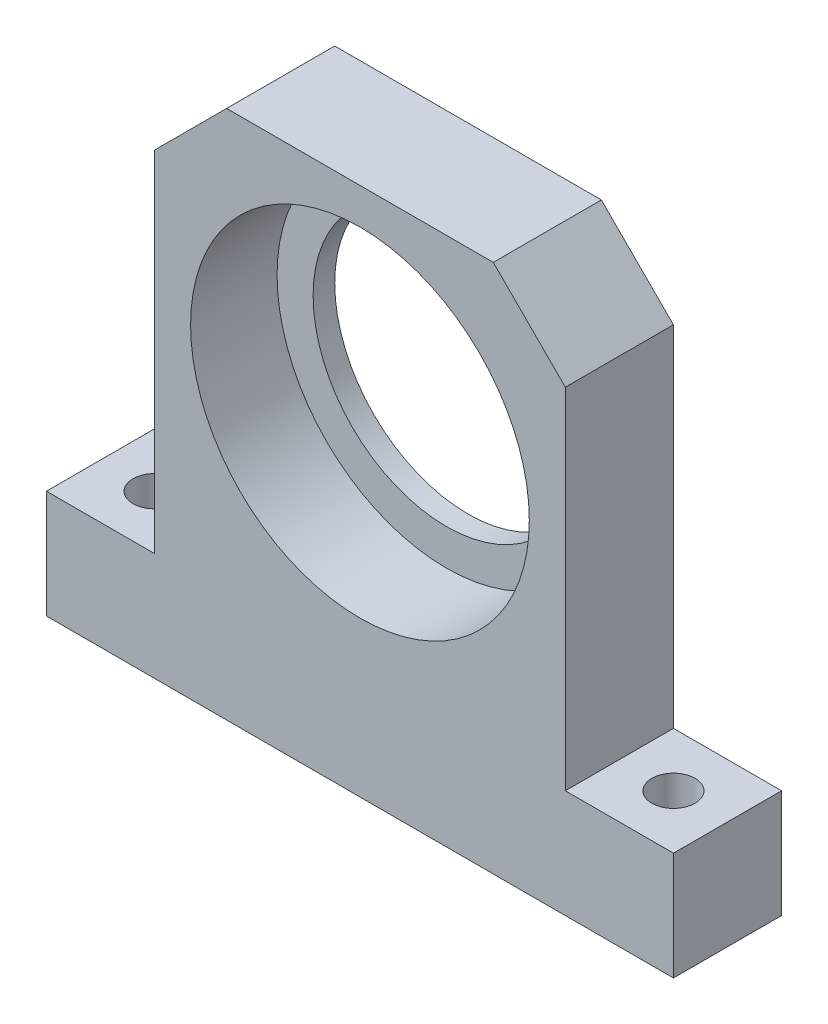
from build123d import *

# Parameters (mm, degrees)
SKETCH_1_R          = 23.5
EXTRUDE_1_DEPTH     = 15
SKETCH_1_3_R        = 23.5
SKETCH_1_3_R_2      = 18.5
EXTRUDE_2_DEPTH     = 3
SKETCH_2_R          = 3
CUT_EXTRUDE_1_DEPTH = 75.42781738


with BuildPart() as part:
    # 草图1 → 凸台-拉伸1 (new body)
    with BuildSketch(Plane.XY):
        Polygon((-18.5, 28.5), (-28.5, 18.5), (-28.5, -30), (-43.5, -30), (-43.5, -45), (43.5, -45), (43.5, -30), (28.5, -30), (28.5, 18.5), (18.5, 28.5), align=None)
        Circle(SKETCH_1_R, mode=Mode.SUBTRACT)
    extrude(amount=EXTRUDE_1_DEPTH)

    # 草图1<3> → 凸台-拉伸2 (add)
    with BuildSketch(Plane.XY):
        Circle(SKETCH_1_3_R)
        Circle(SKETCH_1_3_R_2, mode=Mode.SUBTRACT)
    extrude(amount=EXTRUDE_2_DEPTH)

    # 草图2 → 切除-拉伸1 (cut, through all)
    with BuildSketch(Plane(origin=(0, -30, 0), x_dir=(1, 0, 0), z_dir=(0, 1, 0))):
        with Locations((-36, -7.5)):
            Circle(SKETCH_2_R)
    cut_extrude_1 = extrude(amount=-CUT_EXTRUDE_1_DEPTH, mode=Mode.SUBTRACT)

    # 镜向1: 切除-拉伸1 across plane
    add(cut_extrude_1.mirror(Plane(origin=(0, 0, 0), x_dir=(0, 0, 1), z_dir=(1, 0, 0))), mode=Mode.SUBTRACT)


solid = part.part
